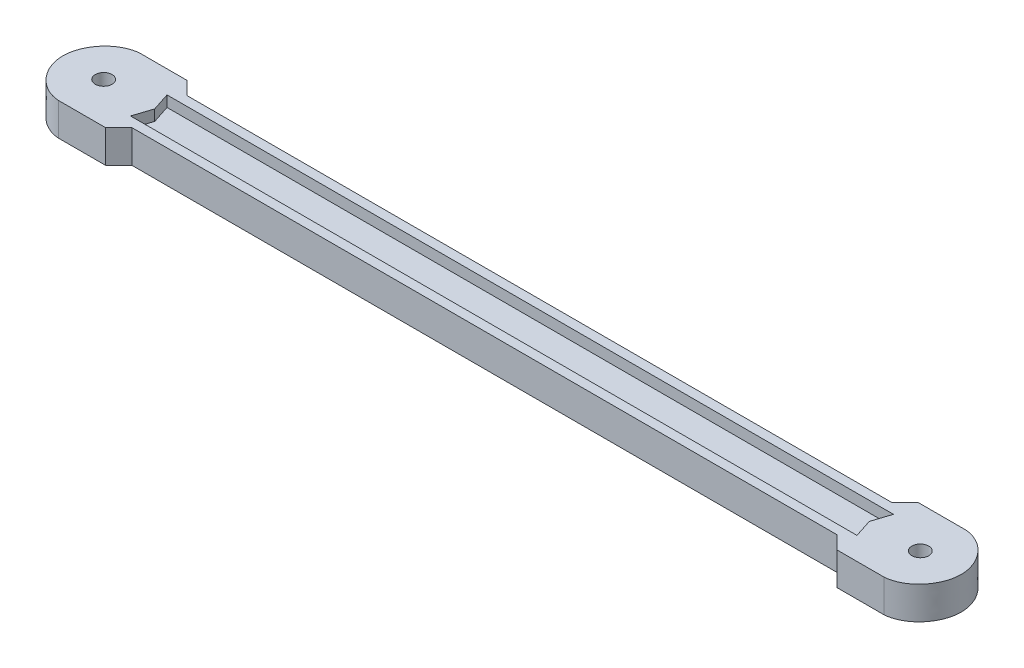
from build123d import *

# Parameters (mm, degrees)
ESQUISSE1_W             = 165
ESQUISSE1_H             = 15
BOSS_EXTRU_1_DEPTH      = 6
ESQUISSE4_W             = 180.64112288
ESQUISSE4_H             = 30
ENL_V_MAT_EXTRU_1_DEPTH = 12
ESQUISSE3_R             = 1.55
ENL_V_MAT_EXTRU_2_DEPTH = 12
ENL_V_MAT_EXTRU_3_DEPTH = 2


with BuildPart() as part:
    # Esquisse1 → Boss.-Extru.1 (new body)
    with BuildSketch(Plane(origin=(0, 0, 0), x_dir=(1, 0, 0), z_dir=(0, 1, 0))):
        Rectangle(ESQUISSE1_W, ESQUISSE1_H)
    extrude(amount=BOSS_EXTRU_1_DEPTH)

    # Esquisse4 → Enlèv. mat.-Extru.1 (cut)
    with BuildSketch(Plane(origin=(0, 6, 0), x_dir=(1, 0, 0), z_dir=(0, 1, 0))):
        Rectangle(ESQUISSE4_W, ESQUISSE4_H)
        with BuildLine():
            Line((-67.159158072, 7.5), (-64.738516234, 5.079358161))
            Line((-64.738516234, 5.079358161), (64.738516234, 5.079358161))
            Line((64.738516234, 5.079358161), (67.159158072, 7.5))
            Line((67.159158072, 7.5), (75, 7.5))
            add(Edge.make_bspline(
                [(75, 7.5), (79.08518124, 7.773957054), (85.914818759, -1e-09), (79.085181242, -7.773957053), (75, -7.5)],
                knots=[0, 0, 0, 0, 0.5, 1, 1, 1, 1], degree=3))
            Line((75, -7.5), (67.159158072, -7.5))
            Line((67.159158072, -7.5), (64.738516234, -5.079358161))
            Line((64.738516234, -5.079358161), (-64.738516234, -5.079358161))
            Line((-64.738516234, -5.079358161), (-67.159158072, -7.5))
            Line((-67.159158072, -7.5), (-75, -7.5))
            add(Edge.make_bspline(
                [(-75, 7.5), (-79.08518124, 7.773957054), (-85.914818759, -1e-09), (-79.085181242, -7.773957053), (-75, -7.5)],
                knots=[0, 0, 0, 0, 0.5, 1, 1, 1, 1], degree=3))
            Line((-75, 7.5), (-67.159158072, 7.5))
        make_face(mode=Mode.SUBTRACT)
    extrude(amount=-ENL_V_MAT_EXTRU_1_DEPTH, mode=Mode.SUBTRACT)

    # Esquisse3 → Enlèv. mat.-Extru.2 (cut)
    with BuildSketch(Plane.XZ):
        with Locations(Location((-75, 0, 0), (0, 0, 270))):
            Circle(ESQUISSE3_R)
        with Locations(Location((75, 0, 0), (0, 0, 270))):
            Circle(ESQUISSE3_R)
    extrude(amount=-ENL_V_MAT_EXTRU_2_DEPTH, mode=Mode.SUBTRACT)

    # Esquisse5 → Enlèv. mat.-Extru.3 (cut)
    with BuildSketch(Plane(origin=(0, 6, 0), x_dir=(1, 0, 0), z_dir=(0, 1, 0))):
        Polygon((-65.624952607, 0), (-66.717415088, 3.351936497), (66.717415088, 3.351936497), (65.624952607, 0), (66.717415088, -3.351936497), (-66.717415088, -3.351936497), align=None)
    extrude(amount=-ENL_V_MAT_EXTRU_3_DEPTH, mode=Mode.SUBTRACT)


solid = part.part
